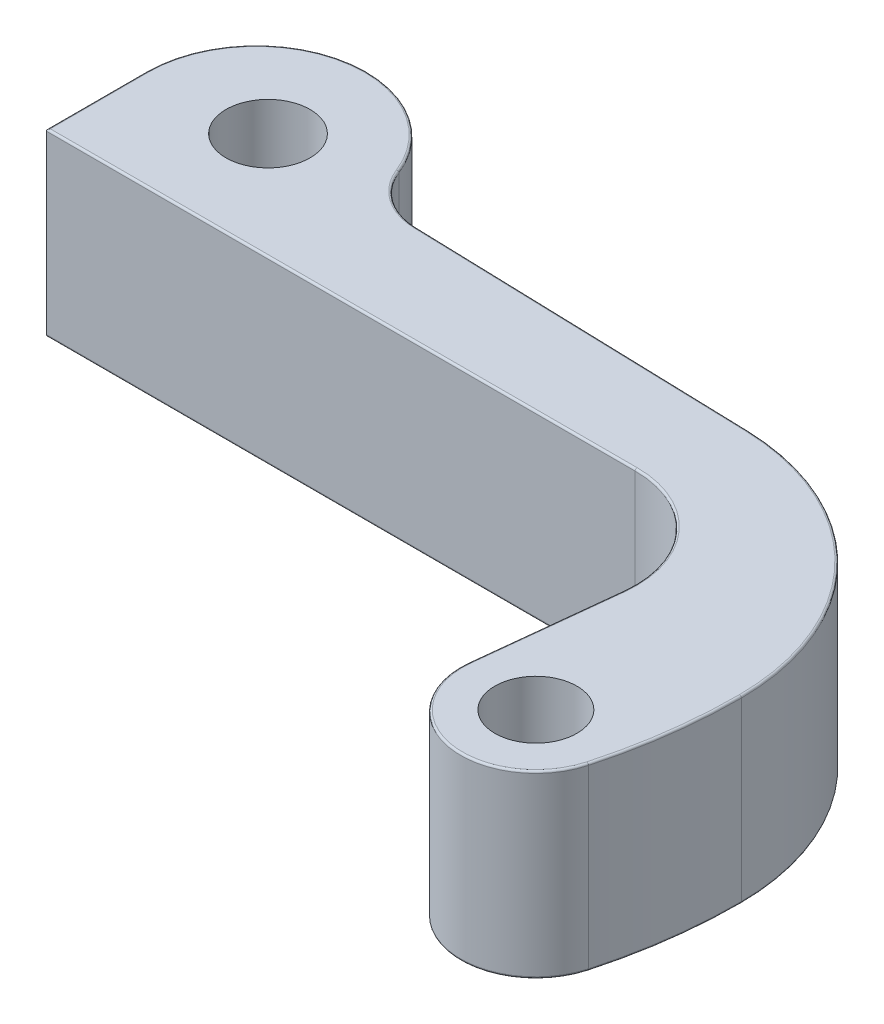
from build123d import *

# Parameters (mm, degrees)
SKETCH_1_R      = 4.1
SKETCH_1_R_2    = 4.2
EXTRUDE_1_DEPTH = 18
FILLET_1_R      = 0.2


with BuildPart() as part:
    # Эскиз1 → Бобышка-Вытянуть1 (new body)
    with BuildSketch(Plane(origin=(0, 0, 0), x_dir=(1, 0, 0), z_dir=(0, 1, 0))):
        with BuildLine():
            Line((0, 0), (58.849762768, 0))
            ThreePointArc((58.849762768, 0), (66.294383343, -3.323352301), (68.790784534, -11.084475102))
            Line((68.790784534, -11.084475102), (67.272727273, -25))
            ThreePointArc((67.272727273, -25), (73.338139081, -33.205921807), (82.0048561, -27.819421161))
            ThreePointArc((82.0048561, -27.819421161), (83.369847365, -21.141684374), (83.818322635, -14.340637419))
            ThreePointArc((83.818322635, -14.340637419), (77.194828854, 1.918929468), (61.12387315, 8.987774352))
            Line((61.12387315, 8.987774352), (26.92989503, 10))
            ThreePointArc((26.92989503, 10), (23.484932233, 11.148153988), (21.244623159, 14.005957604))
            ThreePointArc((21.244623159, 14.005957604), (8.961723124, 20.809506343), (0, 10))
            Line((0, 10), (0, 0))
        make_face()
        with Locations(Location((74.752421844, -25.81596668, 0), (0, 0, 270))):
            Circle(SKETCH_1_R, mode=Mode.SUBTRACT)
        with Locations(Location((11.5, 10.662869651, 0), (0, 0, 270))):
            Circle(SKETCH_1_R_2, mode=Mode.SUBTRACT)
    extrude(amount=EXTRUDE_1_DEPTH)

    # Скругление1
    fillet_1_edges = [part.edges().sort_by_distance(p)[0] for p in [
        (66.294383343, 18, 3.323352301),
        (44.02688409, 0, -9.493887176),
        (77.194828854, 0, -1.918929468),
        (83.369847365, 0, 21.141684374),
        (73.338139081, 0, 33.205921807),
        (68.031755904, 0, 18.042237551),
        (66.294383343, 0, 3.323352301),
        (29.424881384, 0, 0),
        (0, 0, -5),
        (68.031755904, 18, 18.042237551),
        (73.338139081, 18, 33.205921807),
        (83.369847365, 18, 21.141684374),
        (77.194828854, 18, -1.918929468),
        (44.02688409, 18, -9.493887176),
        (23.484932233, 18, -11.148153988),
        (8.961723124, 18, -20.809506343),
        (0, 18, -5),
        (29.424881384, 18, 0),
        (8.961723124, 0, -20.809506343),
        (23.484932233, 0, -11.148153988),
    ]]
    fillet(fillet_1_edges, radius=FILLET_1_R)


solid = part.part
